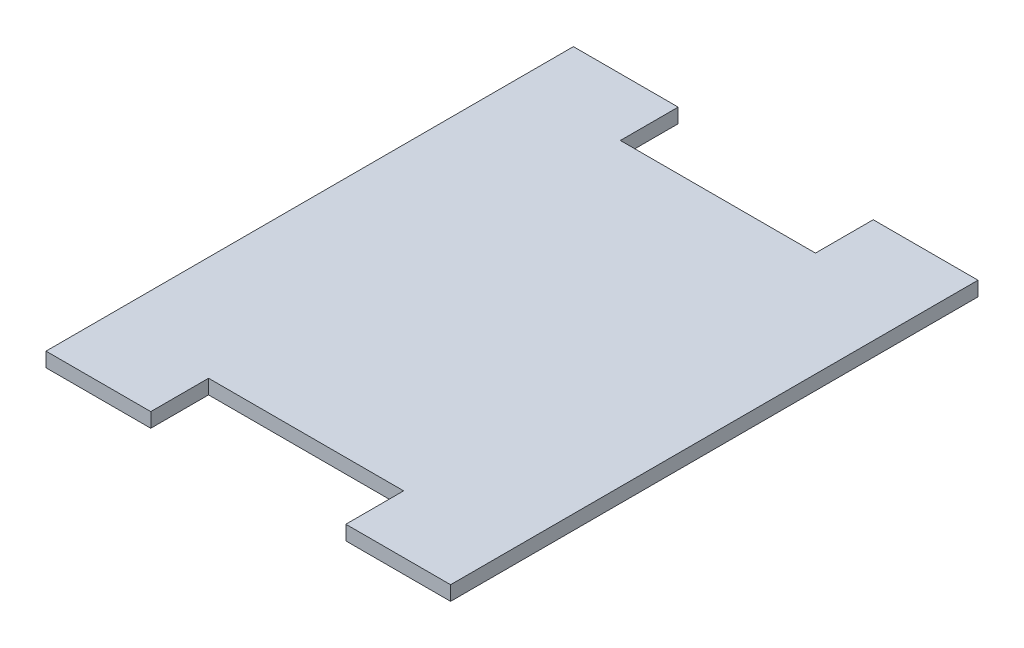
from build123d import *

# Parameters (mm, degrees)
BOSS_EXTRUDE1_DEPTH = 2


with BuildPart() as part:
    # Sketch1 → Boss-Extrude1 (new body)
    with BuildSketch(Plane(origin=(0, 0, 0), x_dir=(1, 0, 0), z_dir=(0, 1, 0))):
        Polygon((13.5, 36.044776119), (-13.5, 36.044776119), (-13.5, 44.044776119), (-28, 44.044776119), (-28, -28.955223881), (-13.5, -28.955223881), (-13.5, -20.955223881), (13.5, -20.955223881), (13.5, -28.955223881), (28, -28.955223881), (28, 44.044776119), (13.5, 44.044776119), align=None)
    extrude(amount=BOSS_EXTRUDE1_DEPTH)


solid = part.part
